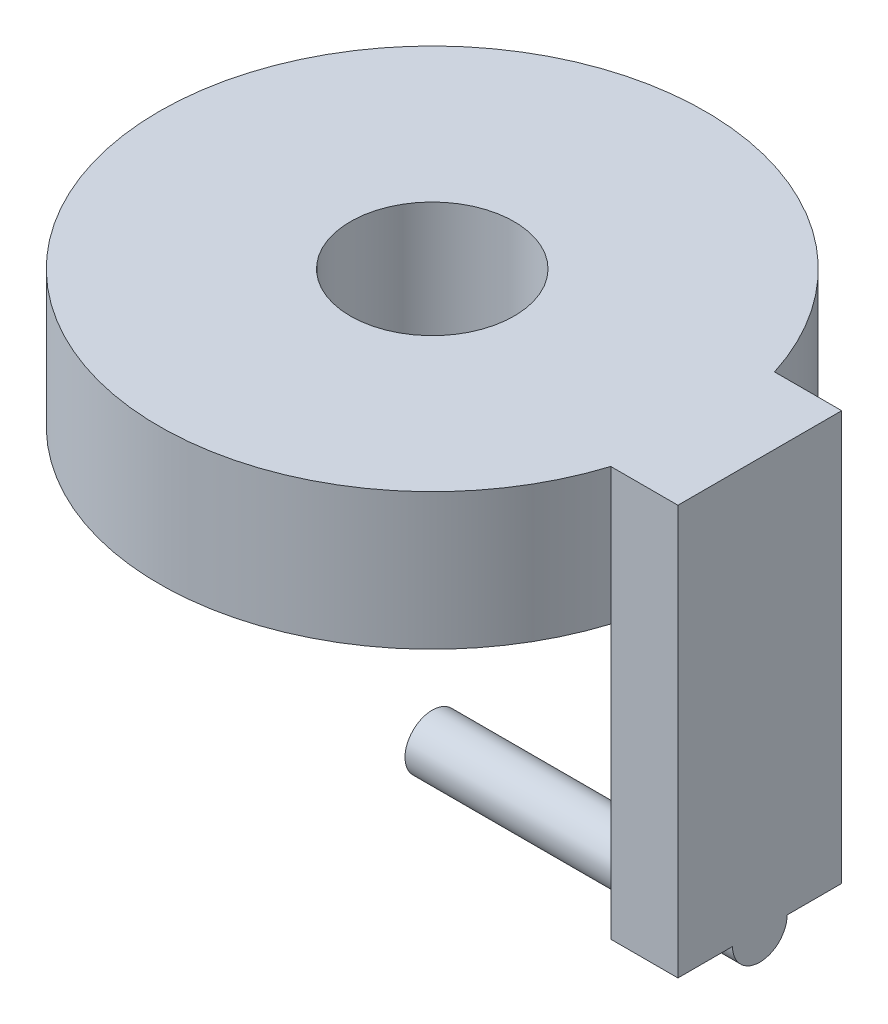
from build123d import *

# Parameters (mm, degrees)
SKETCH2_R           = 50
SKETCH2_R_2         = 15
BOSS_EXTRUDE1_DEPTH = 25
BOSS_EXTRUDE2_START = -75
BOSS_EXTRUDE2_DEPTH = 75
SKETCH4_R           = 5
BOSS_EXTRUDE3_DEPTH = 60


with BuildPart() as part:
    # Sketch2 → Boss-Extrude1 (new body)
    with BuildSketch(Plane(origin=(0, 0, 0), x_dir=(1, 0, 0), z_dir=(0, 1, 0))):
        with Locations(Location((0, 0, 0), (0, 0, 270))):
            Circle(SKETCH2_R)
        with Locations(Location((0, 0, 0), (0, 0, 270))):
            Circle(SKETCH2_R_2, mode=Mode.SUBTRACT)
    extrude(amount=BOSS_EXTRUDE1_DEPTH)

    # Sketch3 → Boss-Extrude2 (add)
    with BuildSketch(Plane(origin=(0, 25, 0), x_dir=(1, 0, 0), z_dir=(0, 1, 0)).offset(BOSS_EXTRUDE2_START)):
        with BuildLine():
            Line((47.696960071, 15), (60, 15))
            Line((60, 15), (60, -15))
            Line((60, -15), (47.696960071, -15))
            ThreePointArc((47.696960071, -15), (50, 0), (47.696960071, 15))
        make_face()
    extrude(amount=BOSS_EXTRUDE2_DEPTH)

    # Sketch4 → Boss-Extrude3 (add)
    with BuildSketch(Plane(origin=(60, 0, 0), x_dir=(0, 0, -1), z_dir=(1, 0, 0))):
        with Locations((0, -50)):
            Circle(SKETCH4_R)
    extrude(amount=-BOSS_EXTRUDE3_DEPTH)


solid = part.part
